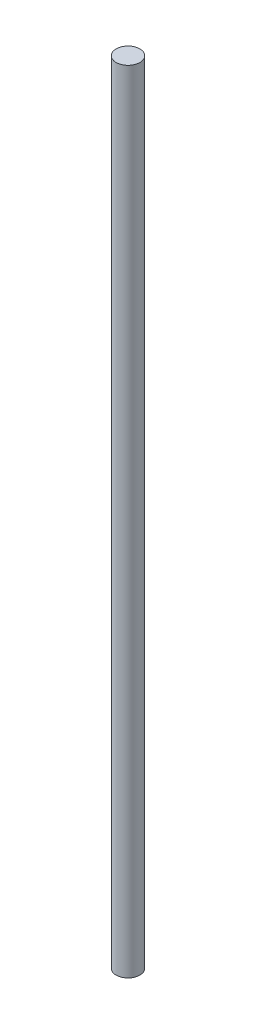
from build123d import *

# Parameters (mm, degrees)
SKETCH1_R           = 1.5
BOSS_EXTRUDE1_DEPTH = 100.076


with BuildPart() as part:
    # Sketch1 → Boss-Extrude1 (new body)
    with BuildSketch(Plane(origin=(0, 0, 0), x_dir=(1, 0, 0), z_dir=(0, 1, 0))):
        with Locations(Location((0, 0, 0), (0, 0, 270))):
            Circle(SKETCH1_R)
    extrude(amount=BOSS_EXTRUDE1_DEPTH)


solid = part.part
